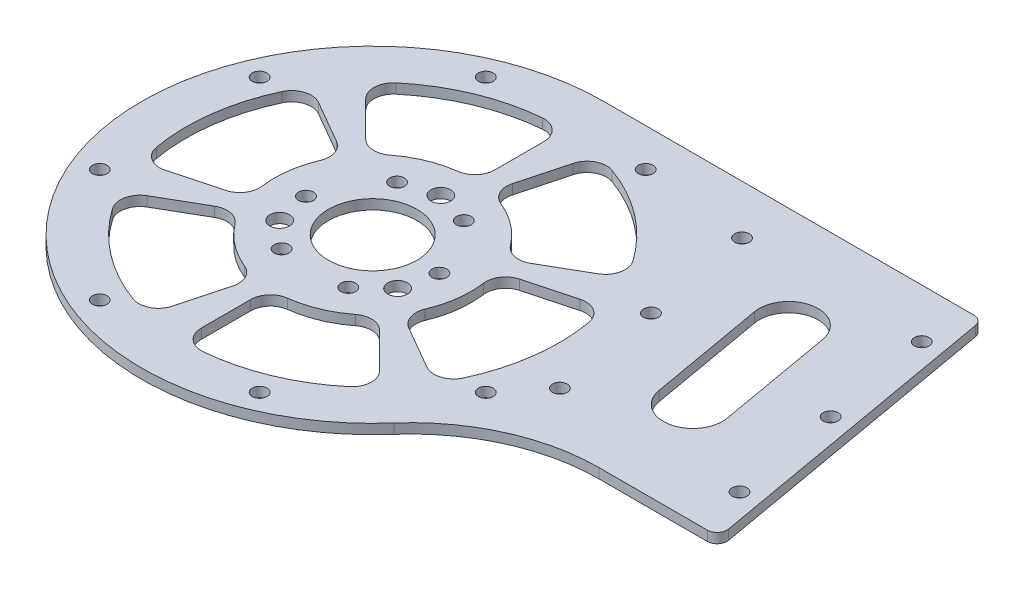
from build123d import *

# Parameters (mm, degrees)
SKETCH_1_R               = 1.5
SKETCH_1_R_2             = 9
SKETCH_1_R_3             = 2
EXTRUDE_1_DEPTH          = 2
CUT_EXTRUDE_1_DEPTH      = 100.85333965
CUT_EXTRUDE_1_DEPTH_BACK = 100.85333965
SKETCH_2_R               = 1.5
CUT_EXTRUDE_2_DEPTH      = 100.85333965
CUT_EXTRUDE_2_DEPTH_BACK = 100.85333965


with BuildPart() as part:
    # 草图1 → 凸台-拉伸1 (new body)
    with BuildSketch(Plane(origin=(0, 0, 0), x_dir=(1, 0, 0), z_dir=(0, 1, 0))):
        with BuildLine():
            Line((0, 47), (75.321800738, 47))
            ThreePointArc((75.321800738, 47), (76.607375957, 46.532088886), (77.291416244, 45.347296355))
            Line((77.291416244, 45.347296355), (88.047362067, -15.652703645))
            ThreePointArc((88.047362067, -15.652703645), (87.609835447, -17.285575219), (86.077746561, -18))
            Line((86.077746561, -18), (64.077746561, -18))
            ThreePointArc((64.077746561, -18), (48.289235397, -21.406433974), (35.309770387, -31.019673035))
            ThreePointArc((35.309770387, -31.019673035), (-42.818948099, -19.378794691), (0, 47))
        make_face()
        with Locations(Location((-16.264045876, 39.264880132, 0), (0, 0, 270))):
            Circle(SKETCH_1_R, mode=Mode.SUBTRACT)
        with Locations(Location((16.264045876, 39.264880132, 0), (0, 0, 270))):
            Circle(SKETCH_1_R, mode=Mode.SUBTRACT)
        with Locations(Location((39.264880132, -16.264045876, 0), (0, 0, 270))):
            Circle(SKETCH_1_R, mode=Mode.SUBTRACT)
        with Locations(Location((16.264045876, -39.264880132, 0), (0, 0, 270))):
            Circle(SKETCH_1_R, mode=Mode.SUBTRACT)
        with Locations(Location((-16.264045876, -39.264880132, 0), (0, 0, 270))):
            Circle(SKETCH_1_R, mode=Mode.SUBTRACT)
        with Locations(Location((-39.264880132, -16.264045876, 0), (0, 0, 270))):
            Circle(SKETCH_1_R, mode=Mode.SUBTRACT)
        with Locations(Location((-39.264880132, 16.264045876, 0), (0, 0, 270))):
            Circle(SKETCH_1_R, mode=Mode.SUBTRACT)
        with Locations(Location((0, 0, 0), (0, 0, 270))):
            Circle(SKETCH_1_R_2, mode=Mode.SUBTRACT)
        with Locations(Location((-6.783865663, 11.75, 0), (0, 0, 270))):
            Circle(SKETCH_1_R, mode=Mode.SUBTRACT)
        with Locations(Location((6.783865663, 11.75, 0), (0, 0, 270))):
            Circle(SKETCH_1_R, mode=Mode.SUBTRACT)
        with Locations(Location((13.567731326, 0, 0), (0, 0, 270))):
            Circle(SKETCH_1_R, mode=Mode.SUBTRACT)
        with Locations(Location((6.783865663, -11.75, 0), (0, 0, 270))):
            Circle(SKETCH_1_R, mode=Mode.SUBTRACT)
        with Locations(Location((-6.783865663, -11.75, 0), (0, 0, 270))):
            Circle(SKETCH_1_R, mode=Mode.SUBTRACT)
        with Locations(Location((-13.567731326, 0, 0), (0, 0, 270))):
            Circle(SKETCH_1_R, mode=Mode.SUBTRACT)
        with Locations(Location((0, 13.856406461, 0), (0, 0, 270))):
            Circle(SKETCH_1_R_3, mode=Mode.SUBTRACT)
        with Locations(Location((-12, -6.92820323, 0), (0, 0, 270))):
            Circle(SKETCH_1_R_3, mode=Mode.SUBTRACT)
        with Locations(Location((12, -6.92820323, 0), (0, 0, 270))):
            Circle(SKETCH_1_R_3, mode=Mode.SUBTRACT)
    extrude(amount=EXTRUDE_1_DEPTH)

    # 草图2 → 切除-拉伸1 (cut, two sides: drawn at the far end of the back side and taken through both)
    with BuildSketch(Plane(origin=(0, 2, 0), x_dir=(1, 0, 0), z_dir=(0, 1, 0)).offset(-CUT_EXTRUDE_1_DEPTH_BACK)):
        with Locations(Location((74.70156336, 37, 0), (0, 0, 270))):
            Circle(SKETCH_2_R)
        with Locations(Location((78.668920425, 14.5, 0), (0, 0, 270))):
            Circle(SKETCH_2_R)
        with Locations(Location((82.636277491, -8, 0), (0, 0, 270))):
            Circle(SKETCH_2_R)
        with Locations(Location((38.146205332, 37, 0), (0, 0, 270))):
            Circle(SKETCH_2_R)
        with Locations(Location((46.080919464, -8, 0), (0, 0, 270))):
            Circle(SKETCH_2_R)
        with Locations(Location((42.113562398, 14.5, 0), (0, 0, 270))):
            Circle(SKETCH_2_R)
        with BuildLine():
            Line((64.216309798, 27.359582102), (68.383866062, 3.72419603))
            ThreePointArc((68.383866062, 3.72419603), (63.51690861, -3.226539554), (56.566173025, 1.640417898))
            Line((56.566173025, 1.640417898), (52.398616761, 25.27580397))
            ThreePointArc((52.398616761, 25.27580397), (57.265574214, 32.226539554), (64.216309798, 27.359582102))
        make_face()
    extrude(amount=CUT_EXTRUDE_1_DEPTH + CUT_EXTRUDE_1_DEPTH_BACK, mode=Mode.SUBTRACT)

    # 草图3 → 切除-拉伸2 (cut, two sides: drawn at the far end of the back side and taken through both)
    with BuildSketch(Plane.XZ.offset(-CUT_EXTRUDE_2_DEPTH_BACK)):
        with BuildLine():
            ThreePointArc((7.550595775, -18.519948797), (12.17522858, -15.867066806), (15.934658856, -12.086630926))
            ThreePointArc((15.934658856, -12.086630926), (18.33030278, -10.583005244), (21.121590627, -11.039855496))
            Line((21.121590627, -11.039855496), (29.830018752, -16.067668818))
            ThreePointArc((29.830018752, -16.067668818), (31.73567133, -18.668128181), (31.104138605, -21.829625778))
            ThreePointArc((31.104138605, -21.829625778), (23.132934302, -30.147426931), (13.035455865, -35.694213682))
            ThreePointArc((13.035455865, -35.694213682), (9.818230989, -35.485971662), (7.799599311, -32.972204212))
            Line((7.799599311, -32.972204212), (5.197011625, -23.259214737))
            ThreePointArc((5.197011625, -23.259214737), (5.478166623, -20.44479617), (7.550595775, -18.519948797))
        make_face()
        with BuildLine():
            ThreePointArc((-12.263448247, -15.798982153), (-7.653668647, -18.47759065), (-2.5, -19.843134833))
            ThreePointArc((-2.5, -19.843134833), (0, -21.166010489), (1, -23.8117618))
            Line((1, -23.8117618), (1, -33.867388444))
            ThreePointArc((1, -33.867388444), (-0.29923758, -36.817961668), (-3.352941176, -37.851787084))
            ThreePointArc((-3.352941176, -37.851787084), (-14.54197043, -35.107422235), (-24.394367884, -29.13614277))
            ThreePointArc((-24.394367884, -29.13614277), (-25.822637443, -26.245823287), (-24.654966811, -23.240753248))
            Line((-24.654966811, -23.240753248), (-17.544565022, -16.130351459))
            ThreePointArc((-17.544565022, -16.130351459), (-14.966629547, -14.966629547), (-12.263448247, -15.798982153))
        make_face()
        with BuildLine():
            ThreePointArc((-19.814044022, 2.720966644), (-19.828897227, -2.610523844), (-18.434658856, -7.756503907))
            ThreePointArc((-18.434658856, -7.756503907), (-18.33030278, -10.583005244), (-20.121590627, -12.771906304))
            Line((-20.121590627, -12.771906304), (-28.830018752, -17.799719626))
            ThreePointArc((-28.830018752, -17.799719626), (-32.03490891, -18.149833488), (-34.457079782, -16.022161306))
            ThreePointArc((-34.457079782, -16.022161306), (-37.674904732, -4.959995304), (-37.429823749, 6.558070912))
            ThreePointArc((-37.429823749, 6.558070912), (-35.640868431, 9.240148374), (-32.454566122, 9.731450963))
            Line((-32.454566122, 9.731450963), (-22.741576647, 7.128863277))
            ThreePointArc((-22.741576647, 7.128863277), (-20.44479617, 5.478166623), (-19.814044022, 2.720966644))
        make_face()
        with BuildLine():
            ThreePointArc((-7.550595775, 18.519948797), (-12.17522858, 15.867066806), (-15.934658856, 12.086630926))
            ThreePointArc((-15.934658856, 12.086630926), (-18.33030278, 10.583005244), (-21.121590627, 11.039855496))
            Line((-21.121590627, 11.039855496), (-29.830018752, 16.067668818))
            ThreePointArc((-29.830018752, 16.067668818), (-31.73567133, 18.668128181), (-31.104138605, 21.829625778))
            ThreePointArc((-31.104138605, 21.829625778), (-23.132934302, 30.147426931), (-13.035455865, 35.694213682))
            ThreePointArc((-13.035455865, 35.694213682), (-9.818230989, 35.485971662), (-7.799599311, 32.972204212))
            Line((-7.799599311, 32.972204212), (-5.197011625, 23.259214737))
            ThreePointArc((-5.197011625, 23.259214737), (-5.478166623, 20.44479617), (-7.550595775, 18.519948797))
        make_face()
        with BuildLine():
            ThreePointArc((12.263448247, 15.798982153), (7.653668647, 18.47759065), (2.5, 19.843134833))
            ThreePointArc((2.5, 19.843134833), (0, 21.166010489), (-1, 23.8117618))
            Line((-1, 23.8117618), (-1, 33.867388444))
            ThreePointArc((-1, 33.867388444), (0.29923758, 36.817961668), (3.352941176, 37.851787084))
            ThreePointArc((3.352941176, 37.851787084), (14.54197043, 35.107422235), (24.394367884, 29.13614277))
            ThreePointArc((24.394367884, 29.13614277), (25.822637443, 26.245823287), (24.654966811, 23.240753248))
            Line((24.654966811, 23.240753248), (17.544565022, 16.130351459))
            ThreePointArc((17.544565022, 16.130351459), (14.966629547, 14.966629547), (12.263448247, 15.798982153))
        make_face()
        with BuildLine():
            ThreePointArc((19.814044022, -2.720966644), (19.828897227, 2.610523844), (18.434658856, 7.756503907))
            ThreePointArc((18.434658856, 7.756503907), (18.33030278, 10.583005244), (20.121590627, 12.771906304))
            Line((20.121590627, 12.771906304), (28.830018752, 17.799719626))
            ThreePointArc((28.830018752, 17.799719626), (32.03490891, 18.149833488), (34.457079782, 16.022161306))
            ThreePointArc((34.457079782, 16.022161306), (37.674904732, 4.959995304), (37.429823749, -6.558070912))
            ThreePointArc((37.429823749, -6.558070912), (35.640868431, -9.240148374), (32.454566122, -9.731450963))
            Line((32.454566122, -9.731450963), (22.741576647, -7.128863277))
            ThreePointArc((22.741576647, -7.128863277), (20.44479617, -5.478166623), (19.814044022, -2.720966644))
        make_face()
    extrude(amount=CUT_EXTRUDE_2_DEPTH + CUT_EXTRUDE_2_DEPTH_BACK, mode=Mode.SUBTRACT)


solid = part.part
